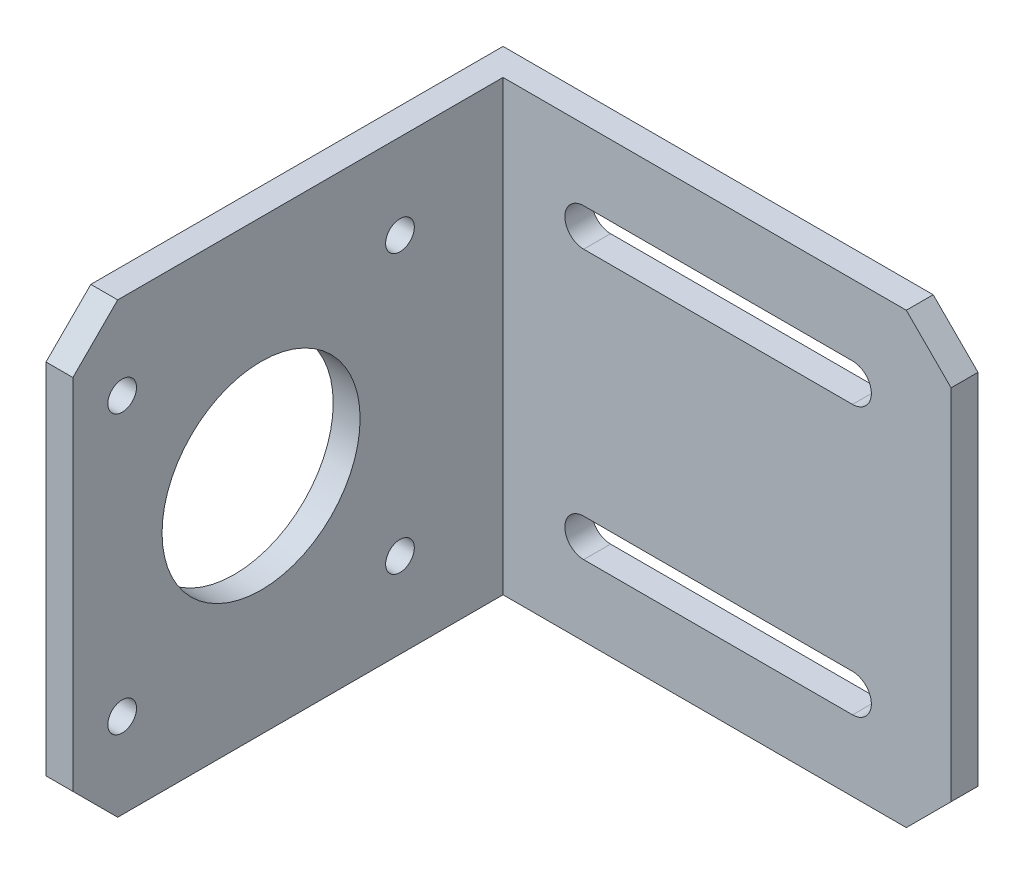
from build123d import *

# Parameters (mm, degrees)
SKETCH_1_W      = 53
SKETCH_1_H      = 50
EXTRUDE_1_DEPTH = 3
SKETCH_2_W      = 51
SKETCH_2_H      = 50
SKETCH_2_R      = 11.05
SKETCH_2_R_2    = 1.6
EXTRUDE_2_DEPTH = 3
CHAMFER_1_SIZE  = 5


with BuildPart() as part:
    # 草图1 → 凸台-拉伸1 (new body)
    with BuildSketch(Plane.XY):
        with Locations((26.5, 25)):
            Rectangle(SKETCH_1_W, SKETCH_1_H)
        with BuildLine():
            Line((12, 42.1), (42, 42.1))
            ThreePointArc((42, 42.1), (44.1, 40), (42, 37.9))
            Line((42, 37.9), (12, 37.9))
            ThreePointArc((12, 37.9), (9.9, 40), (12, 42.1))
        make_face(mode=Mode.SUBTRACT)
        with BuildLine():
            Line((12, 7.9), (42, 7.9))
            ThreePointArc((42, 7.9), (44.1, 10), (42, 12.1))
            Line((42, 12.1), (12, 12.1))
            ThreePointArc((12, 12.1), (9.9, 10), (12, 7.9))
        make_face(mode=Mode.SUBTRACT)
    extrude(amount=EXTRUDE_1_DEPTH)

    # 草图2 → 凸台-拉伸2 (add)
    with BuildSketch(Plane.ZY):
        with Locations((25.5, 25)):
            Rectangle(SKETCH_2_W, SKETCH_2_H)
        with Locations((30, 25)):
            Circle(SKETCH_2_R, mode=Mode.SUBTRACT)
        with Locations((45.5, 40.5)):
            Circle(SKETCH_2_R_2, mode=Mode.SUBTRACT)
        with Locations((45.5, 9.5)):
            Circle(SKETCH_2_R_2, mode=Mode.SUBTRACT)
        with Locations((14.5, 9.5)):
            Circle(SKETCH_2_R_2, mode=Mode.SUBTRACT)
        with Locations((14.5, 40.5)):
            Circle(SKETCH_2_R_2, mode=Mode.SUBTRACT)
    extrude(amount=-EXTRUDE_2_DEPTH)

    # 倒角1
    chamfer_1_edges = [part.edges().sort_by_distance(p)[0] for p in [
        (1.5, 0, 51),
        (1.5, 50, 51),
        (53, 50, 1.5),
        (53, 0, 1.5),
    ]]
    chamfer(chamfer_1_edges, length=CHAMFER_1_SIZE)


solid = part.part
